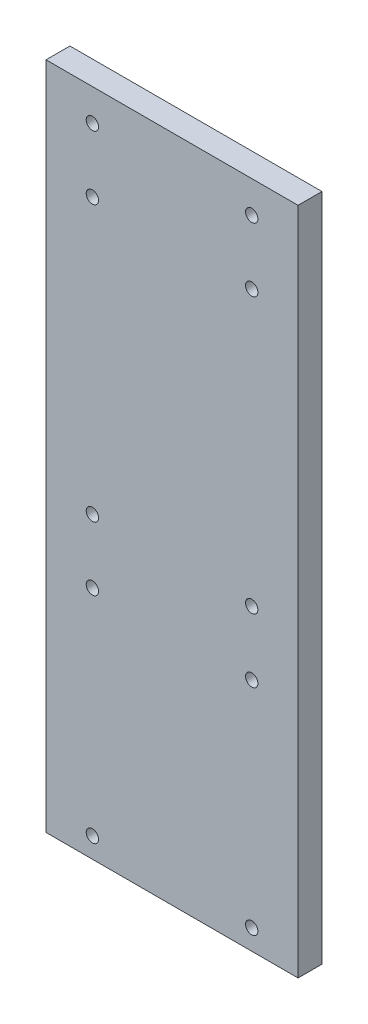
from build123d import *

# Parameters (mm, degrees)
SZKIC1_W                    = 63.27
SZKIC1_H                    = 168
DODANIE_WYCI_GNI_CIE1_DEPTH = 6
SZKIC5_R                    = 1.55
WYTNIJ_WYCI_GNI_CIE1_DEPTH  = 6
SZYK_LINIOWY1_COUNT         = 2
SZYK_LINIOWY1_PITCH         = 16


with BuildPart() as part:
    # Szkic1 → Dodanie-wyciągnięcie1 (new body)
    with BuildSketch(Plane.XY):
        with Locations((1183.133039301, -877.922207314)):
            Rectangle(SZKIC1_W, SZKIC1_H)
    extrude(amount=DODANIE_WYCI_GNI_CIE1_DEPTH)

    # Szkic5 → Wytnij-wyciągnięcie1 (cut)
    with BuildSketch(Plane.XY.offset(6)):
        with Locations((1203.133039301, -956.822207314)):
            Circle(SZKIC5_R)
        with Locations((1163.133039301, -956.822207314)):
            Circle(SZKIC5_R)
        with Locations((1163.133039301, -886.922207314)):
            Circle(SZKIC5_R)
        with Locations((1203.133039301, -886.922207314)):
            Circle(SZKIC5_R)
        with Locations((1203.133039301, -801.922207314)):
            Circle(SZKIC5_R)
        with Locations((1163.133039301, -801.922207314)):
            Circle(SZKIC5_R)
    wytnij_wyci_gni_cie1 = extrude(amount=-WYTNIJ_WYCI_GNI_CIE1_DEPTH, mode=Mode.SUBTRACT)

    # Szyk liniowy1: Wytnij-wyciągnięcie1 ×2
    with Locations(*[(0, -i * SZYK_LINIOWY1_PITCH, 0) for i in range(1, SZYK_LINIOWY1_COUNT)]):
        add(wytnij_wyci_gni_cie1, mode=Mode.SUBTRACT)


solid = part.part
